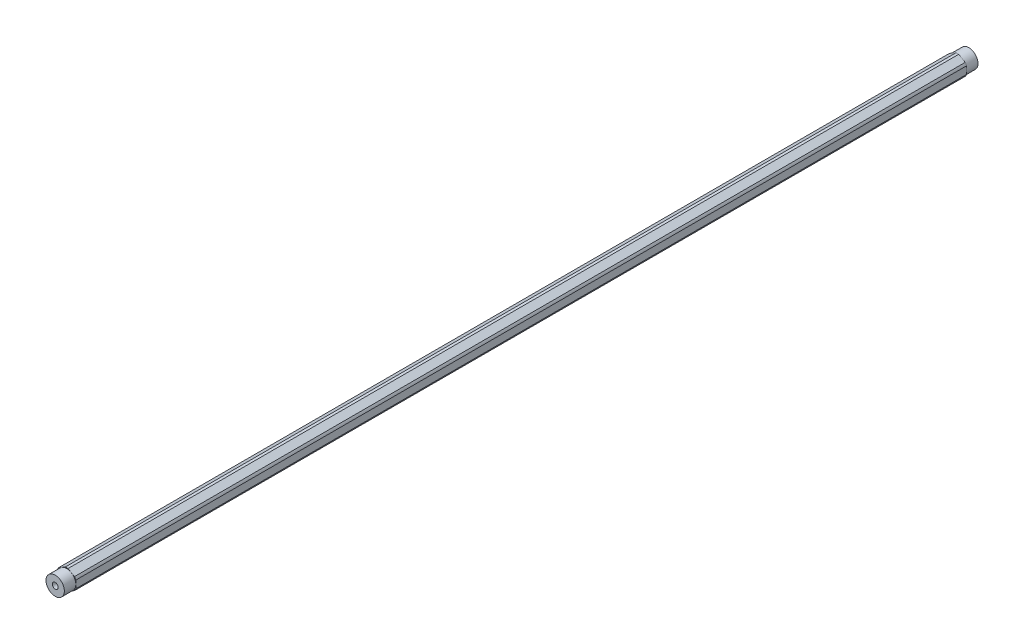
from build123d import *

# Parameters (mm, degrees)
SKETCH2_R                            = 2.0193
BOSS_EXTRUDE1_DEPTH                  = 307.975
SKETCH7_R                            = 6.35
BOSS_EXTRUDE2_DEPTH                  = 7.9375
F_10_32_TAPPED_HOLE2_D               = 4.0386
F_10_32_TAPPED_HOLE2_DEPTH           = 16.34744
F_10_32_TAPPED_HOLE2_TIP             = 1.213317848
F_10_32_TAPPED_HOLE2_ON_FACE_2_D     = 4.0386
F_10_32_TAPPED_HOLE2_ON_FACE_2_DEPTH = 16.34744
F_10_32_TAPPED_HOLE2_ON_FACE_2_TIP   = 1.213317848


with BuildPart() as part:
    # Sketch2 → Boss-Extrude1 (new, symmetric)
    with BuildSketch(Plane.XY):
        with BuildLine():
            ThreePointArc((0.93173274, 6.79441227), (0, 6.858), (-0.93173274, 6.79441227))
            Line((-0.93173274, 6.79441227), (-5.41826726, 4.204110358))
            ThreePointArc((-5.41826726, 4.204110358), (-5.939202219, 3.429), (-6.35, 2.590301913))
            Line((-6.35, 2.590301913), (-6.35, -2.590301913))
            ThreePointArc((-6.35, -2.590301913), (-5.939202219, -3.429), (-5.41826726, -4.204110358))
            Line((-5.41826726, -4.204110358), (-0.93173274, -6.79441227))
            ThreePointArc((-0.93173274, -6.79441227), (0, -6.858), (0.93173274, -6.79441227))
            Line((0.93173274, -6.79441227), (5.41826726, -4.204110358))
            ThreePointArc((5.41826726, -4.204110358), (5.939202219, -3.429), (6.35, -2.590301913))
            Line((6.35, -2.590301913), (6.35, 2.590301913))
            ThreePointArc((6.35, 2.590301913), (5.939202219, 3.429), (5.41826726, 4.204110358))
            Line((5.41826726, 4.204110358), (0.93173274, 6.79441227))
        make_face()
        Circle(SKETCH2_R, mode=Mode.SUBTRACT)
    extrude(amount=BOSS_EXTRUDE1_DEPTH, both=True)

    # Sketch7 → Boss-Extrude2 (add)
    with BuildSketch(Plane.XY.offset(307.975)):
        Circle(SKETCH7_R)
    boss_extrude2 = extrude(amount=BOSS_EXTRUDE2_DEPTH)

    # Mirror1: Boss-Extrude2 across plane
    add(boss_extrude2.mirror(Plane.XY))

    # #10-32 Tapped Hole2
    with Locations(Plane.XY.offset(315.9125)):
        with Locations((0, 0)):
            Hole(F_10_32_TAPPED_HOLE2_D / 2, depth=F_10_32_TAPPED_HOLE2_DEPTH)
            with Locations((0, 0, -(F_10_32_TAPPED_HOLE2_DEPTH + F_10_32_TAPPED_HOLE2_TIP / 2))):  # 118° drill point
                Cone(0, F_10_32_TAPPED_HOLE2_D / 2, F_10_32_TAPPED_HOLE2_TIP, mode=Mode.SUBTRACT)

    # #10-32 Tapped Hole2 on face 2
    with Locations(Plane(origin=(0, 0, -315.9125), x_dir=(-1, 0, 0), z_dir=(0, 0, -1))):
        with Locations((0, 0)):
            Hole(F_10_32_TAPPED_HOLE2_ON_FACE_2_D / 2, depth=F_10_32_TAPPED_HOLE2_ON_FACE_2_DEPTH)
            with Locations((0, 0, -(F_10_32_TAPPED_HOLE2_ON_FACE_2_DEPTH + F_10_32_TAPPED_HOLE2_ON_FACE_2_TIP / 2))):  # 118° drill point
                Cone(0, F_10_32_TAPPED_HOLE2_ON_FACE_2_D / 2, F_10_32_TAPPED_HOLE2_ON_FACE_2_TIP, mode=Mode.SUBTRACT)


solid = part.part
